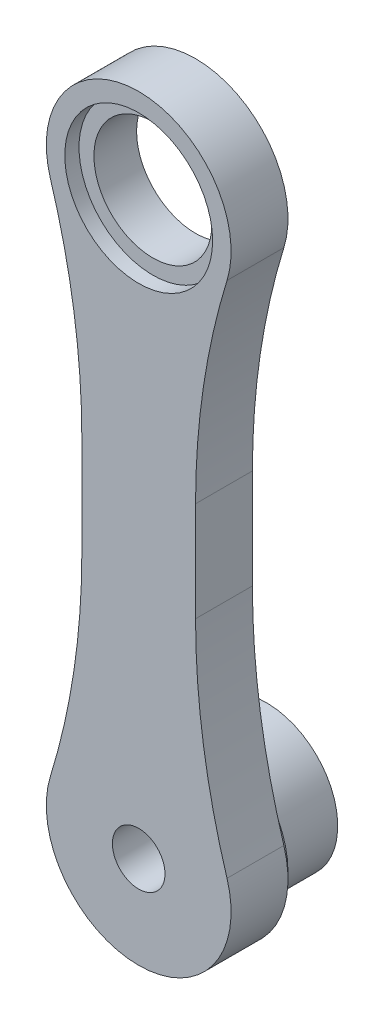
from build123d import *

# Parameters (mm, degrees)
SKETCH_1_R          = 4.15
EXTRUDE_1_DEPTH     = 4
FILLET_1_R          = 50
SKETCH_4_R          = 5
EXTRUDE_2_DEPTH     = 5
SKETCH_5_R          = 6
EXTRUDE_3_DEPTH     = 0.5
SKETCH_6_R          = 3.15
CUT_EXTRUDE_2_DEPTH = 3
SKETCH_7_R          = 1.85
CUT_EXTRUDE_3_DEPTH = 10
SKETCH_8_R          = 5.2
CUT_EXTRUDE_4_DEPTH = 1


with BuildPart() as part:
    # 草图1 → 凸台-拉伸1 (new body)
    with BuildSketch(Plane.XY):
        with BuildLine():
            Line((-5.999958142, -11.451976213), (-5.999958142, -41.451976213))
            ThreePointArc((-5.999958142, -41.451976213), (-1.999958142, -53.075451596), (2.000041858, -41.451976213))
            Line((2.000041858, -41.451976213), (2.000041858, -11.451976213))
            ThreePointArc((2.000041858, -11.451976213), (-1.999958142, 0.17149917), (-5.999958142, -11.451976213))
        make_face()
        with Locations(Location((-1.999958142, -6.32850083, 0), (0, 0, 180))):
            Circle(SKETCH_1_R, mode=Mode.SUBTRACT)
    extrude(amount=EXTRUDE_1_DEPTH)

    # 圆角1
    fillet_1_edges = [part.edges().sort_by_distance(p)[0] for p in [
        (-5.999958142, -41.451976213, 2),
        (-5.999958142, -11.451976213, 2),
        (2.000041858, -11.451976213, 2),
        (2.000041858, -41.451976213, 2),
    ]]
    fillet(fillet_1_edges, radius=FILLET_1_R)

    # 草图4 → 凸台-拉伸2 (add)
    with BuildSketch(Plane(origin=(0, 0, 0), x_dir=(-1, 0, 0), z_dir=(0, 0, -1))):
        with Locations((1.999958142, -46.575451596)):
            Circle(SKETCH_4_R)
    extrude(amount=EXTRUDE_2_DEPTH)

    # 草图5 → 凸台-拉伸3 (add)
    with BuildSketch(Plane(origin=(0, 0, 0), x_dir=(-1, 0, 0), z_dir=(0, 0, -1))):
        with Locations((1.999958142, -46.575451596)):
            Circle(SKETCH_5_R)
    extrude(amount=EXTRUDE_3_DEPTH)

    # 草图6 → 切除-拉伸2 (cut)
    with BuildSketch(Plane(origin=(0, 0, -5), x_dir=(-1, 0, 0), z_dir=(0, 0, -1))):
        with Locations((1.999958142, -46.575451596)):
            Circle(SKETCH_6_R)
    extrude(amount=-CUT_EXTRUDE_2_DEPTH, mode=Mode.SUBTRACT)

    # 草图7 → 切除-拉伸3 (cut)
    with BuildSketch(Plane(origin=(0, 0, -2), x_dir=(-1, 0, 0), z_dir=(0, 0, -1))):
        with Locations((1.999958142, -46.575451596)):
            Circle(SKETCH_7_R)
    extrude(amount=-CUT_EXTRUDE_3_DEPTH, mode=Mode.SUBTRACT)

    # 草图8 → 切除-拉伸4 (cut)
    with BuildSketch(Plane.XY.offset(4)):
        with Locations((-1.999958142, -6.32850083)):
            Circle(SKETCH_8_R)
    extrude(amount=-CUT_EXTRUDE_4_DEPTH, mode=Mode.SUBTRACT)


solid = part.part
